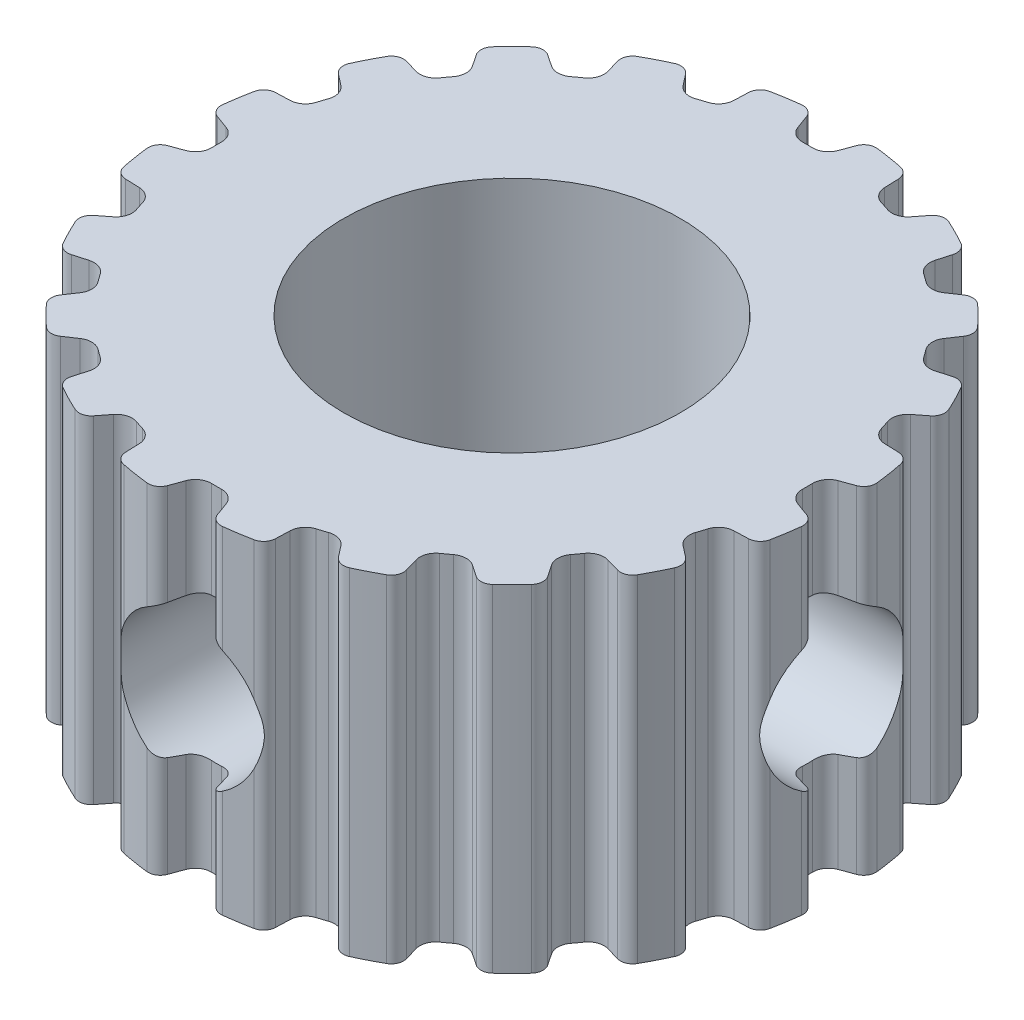
from build123d import *

# Parameters (mm, degrees)
SKETCH1_R                = 6.215
BOSS_EXTRUDE1_DEPTH      = 6.35
CUT_EXTRUDE1_DEPTH       = 11.843198329
FILLET1_R                = 0.3
FILLET2_R                = 0.23
CIRPATTERN1_COUNT        = 20
FILLET1_OF_CIRPATTERN1_R = 0.3
FILLET2_OF_CIRPATTERN1_R = 0.23
SKETCH4_R                = 3.175
CUT_EXTRUDE2_DEPTH       = 11.797818919
SKETCH8_W                = 1.35255
SKETCH8_H                = 6.175370167
CIRPATTERN2_COUNT        = 2
CIRPATTERN2_ANGLE        = 90


with BuildPart() as part:
    # Sketch1 → Boss-Extrude1 (new body)
    with BuildSketch(Plane(origin=(0, 0, 0), x_dir=(1, 0, 0), z_dir=(0, 1, 0))):
        with Locations(Location((0, 0, 0), (0, 0, 270))):
            Circle(SKETCH1_R)
    extrude(amount=BOSS_EXTRUDE1_DEPTH)

    # Sketch2 → Cut-Extrude1 (cut, through all)
    with BuildSketch(Plane(origin=(0, 0, 0), x_dir=(1, 0, 0), z_dir=(0, 1, 0))):
        with BuildLine():
            Line((0.305, 5.566650699), (0.532656669, 6.192132256))
            ThreePointArc((0.532656669, 6.192132256), (0, 6.215), (-0.532656669, 6.192132256))
            Line((-0.532656669, 6.192132256), (-0.305, 5.566650699))
            ThreePointArc((-0.305, 5.566650699), (0, 5.575), (0.305, 5.566650699))
        make_face()
    cut_extrude1 = extrude(amount=CUT_EXTRUDE1_DEPTH, mode=Mode.SUBTRACT)

    # Fillet1
    fillet1_edges = [part.edges().sort_by_distance(p)[0] for p in [
        (-0.305, 3.175, -5.566650699),
        (0.305, 3.175, -5.566650699),
    ]]
    fillet(fillet1_edges, radius=FILLET1_R)

    # Fillet2
    fillet2_edges = [part.edges().sort_by_distance(p)[0] for p in [
        (0.532656669, 3.175, -6.192132256),
        (-0.532656669, 3.175, -6.192132256),
    ]]
    fillet(fillet2_edges, radius=FILLET2_R)

    # CirPattern1: Cut-Extrude1 ×20 about axis
    cirpattern1_axis = Axis((0, 0, 0), (0, 1, 0))
    for i in range(1, CIRPATTERN1_COUNT):
        add(cut_extrude1.rotate(cirpattern1_axis, i * 360 / CIRPATTERN1_COUNT), mode=Mode.SUBTRACT)

    # Fillet1 of CirPattern1
    fillet1_of_cirpattern1_edges = [part.edges().sort_by_distance(p)[0] for p in [
        (-2.010261905, 3.175, -5.199949238),
        (-1.43011743, 3.175, -5.388449604),
        (-3.518745369, 3.175, -4.324240515),
        (-3.025245002, 3.175, -4.682789519),
        (-4.682789519, 3.175, -3.025245002),
        (-4.324240515, 3.175, -3.518745369),
        (-5.388449604, 3.175, -1.43011743),
        (-5.199949238, 3.175, -2.010261905),
        (-5.566650699, 3.175, 0.305),
        (-5.566650699, 3.175, -0.305),
        (-5.199949238, 3.175, 2.010261905),
        (-5.388449604, 3.175, 1.43011743),
        (-4.324240515, 3.175, 3.518745369),
        (-4.682789519, 3.175, 3.025245002),
        (-3.025245002, 3.175, 4.682789519),
        (-3.518745369, 3.175, 4.324240515),
        (-1.43011743, 3.175, 5.388449604),
        (-2.010261905, 3.175, 5.199949238),
        (0.305, 3.175, 5.566650699),
        (-0.305, 3.175, 5.566650699),
        (2.010261905, 3.175, 5.199949238),
        (1.43011743, 3.175, 5.388449604),
        (3.518745369, 3.175, 4.324240515),
        (3.025245002, 3.175, 4.682789519),
        (4.682789519, 3.175, 3.025245002),
        (4.324240515, 3.175, 3.518745369),
        (5.388449604, 3.175, 1.43011743),
        (5.199949238, 3.175, 2.010261905),
        (5.566650699, 3.175, -0.305),
        (5.566650699, 3.175, 0.305),
        (5.199949238, 3.175, -2.010261905),
        (5.388449604, 3.175, -1.43011743),
        (4.324240515, 3.175, -3.518745369),
        (4.682789519, 3.175, -3.025245002),
        (3.025245002, 3.175, -4.682789519),
        (3.518745369, 3.175, -4.324240515),
        (1.43011743, 3.175, -5.388449604),
        (2.010261905, 3.175, -5.199949238),
    ]]
    fillet(fillet1_of_cirpattern1_edges, radius=FILLET1_OF_CIRPATTERN1_R)

    # Fillet2 of CirPattern1
    fillet2_of_cirpattern1_edges = [part.edges().sort_by_distance(p)[0] for p in [
        (-1.406887503, 3.175, -6.053667694),
        (-2.420060694, 3.175, -5.724467769),
        (-3.208715723, 3.175, -5.322627961),
        (-4.070572318, 3.175, -4.696452492),
        (-4.696452492, 3.175, -4.070572318),
        (-5.322627961, 3.175, -3.208715723),
        (-5.724467769, 3.175, -2.420060694),
        (-6.053667694, 3.175, -1.406887503),
        (-6.192132256, 3.175, -0.532656669),
        (-6.192132256, 3.175, 0.532656669),
        (-6.053667694, 3.175, 1.406887503),
        (-5.724467769, 3.175, 2.420060694),
        (-5.322627961, 3.175, 3.208715723),
        (-4.696452492, 3.175, 4.070572318),
        (-4.070572318, 3.175, 4.696452492),
        (-3.208715723, 3.175, 5.322627961),
        (-2.420060694, 3.175, 5.724467769),
        (-1.406887503, 3.175, 6.053667694),
        (-0.532656669, 3.175, 6.192132256),
        (0.532656669, 3.175, 6.192132256),
        (1.406887503, 3.175, 6.053667694),
        (2.420060694, 3.175, 5.724467769),
        (3.208715723, 3.175, 5.322627961),
        (4.070572318, 3.175, 4.696452492),
        (4.696452492, 3.175, 4.070572318),
        (5.322627961, 3.175, 3.208715723),
        (5.724467769, 3.175, 2.420060694),
        (6.053667694, 3.175, 1.406887503),
        (6.192132256, 3.175, 0.532656669),
        (6.192132256, 3.175, -0.532656669),
        (6.053667694, 3.175, -1.406887503),
        (5.724467769, 3.175, -2.420060694),
        (5.322627961, 3.175, -3.208715723),
        (4.696452492, 3.175, -4.070572318),
        (4.070572318, 3.175, -4.696452492),
        (3.208715723, 3.175, -5.322627961),
        (2.420060694, 3.175, -5.724467769),
        (1.406887503, 3.175, -6.053667694),
    ]]
    fillet(fillet2_of_cirpattern1_edges, radius=FILLET2_OF_CIRPATTERN1_R)

    # Sketch4 → Cut-Extrude2 (cut, through all)
    with BuildSketch(Plane(origin=(0, 0, 0), x_dir=(1, 0, 0), z_dir=(0, 1, 0))):
        with Locations(Location((0, 0, 0), (0, 0, 270))):
            Circle(SKETCH4_R)
    extrude(amount=CUT_EXTRUDE2_DEPTH, mode=Mode.SUBTRACT)

    # Sketch8 → #6-32 Tapped Hole1 (revolve, cut)
    with BuildSketch(Plane(origin=(0, 3.175, 0), x_dir=(0, 1, 0), z_dir=(1, 0, 0))):
        with Locations((0.676275, 3.087685084)):
            Rectangle(SKETCH8_W, SKETCH8_H)
    f_6_32_tapped_hole1 = revolve(axis=Axis((0, 3.175, -6.35), (0, 0, 1)), mode=Mode.SUBTRACT)

    # CirPattern2: #6-32 Tapped Hole1 ×2 about axis
    cirpattern2_axis = Axis((0, 6.35, 0), (0, 1, 0))
    for i in range(1, CIRPATTERN2_COUNT):
        add(f_6_32_tapped_hole1.rotate(cirpattern2_axis, i * CIRPATTERN2_ANGLE / (CIRPATTERN2_COUNT - 1)), mode=Mode.SUBTRACT)


solid = part.part
